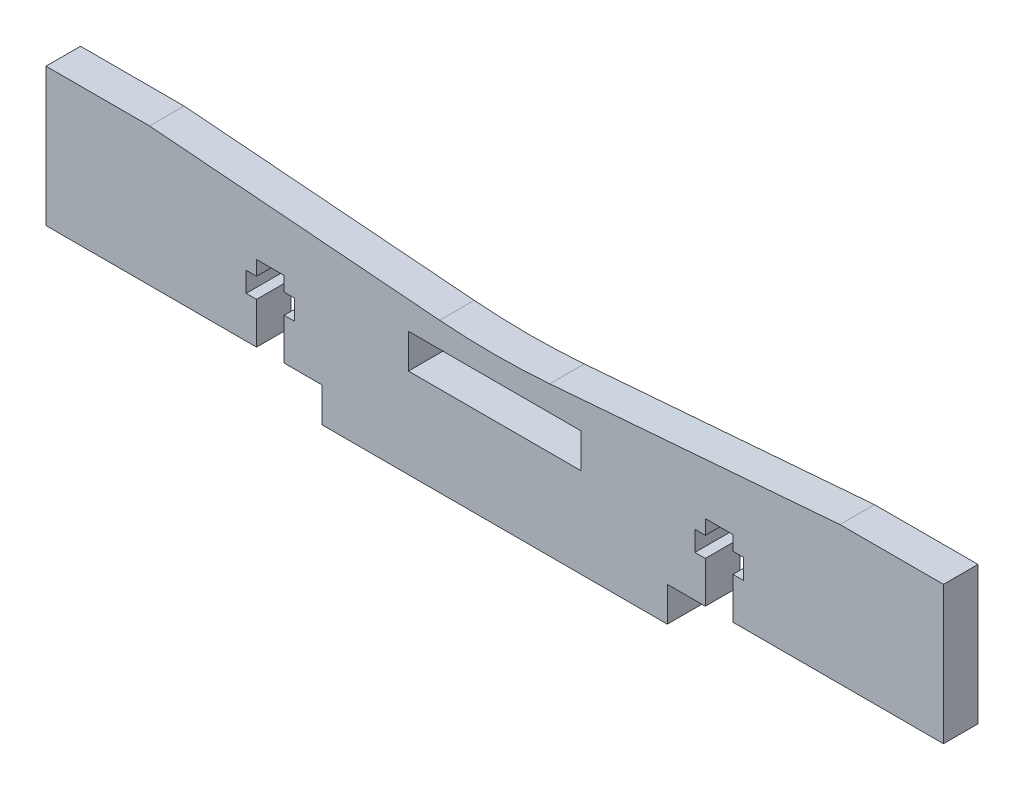
from build123d import *

# Parameters (mm, degrees)
SKETCH_1_W      = 25
SKETCH_1_H      = 5
EXTRUDE_1_DEPTH = 5
FILLET_1_R      = 100


with BuildPart() as part:
    # 草图1 → 凸台-拉伸1 (new body)
    with BuildSketch(Plane.XY):
        Polygon((-40, 0), (-34.5, 0), (-34.5, 6), (-36, 6), (-36, 8.9), (-34.5, 8.9), (-34.5, 11), (-30.5, 11), (-30.5, 8.9), (-29, 8.9), (-29, 6), (-30.5, 6), (-30.5, 0), (0, 0), (0, 20), (-15, 20), (-65, 16), (-115, 20), (-130, 20), (-130, 0), (-99.5, 0), (-99.5, 6), (-101, 6), (-101, 8.9), (-99.5, 8.9), (-99.5, 11), (-95.5, 11), (-95.5, 8.9), (-94, 8.9), (-94, 6), (-95.5, 6), (-95.5, 0), (-90, 0), (-90, -5), (-40, -5), align=None)
        with Locations((-65, 10.5)):
            Rectangle(SKETCH_1_W, SKETCH_1_H, mode=Mode.SUBTRACT)
    extrude(amount=EXTRUDE_1_DEPTH)

    # 圆角1
    fillet_1_edges = [part.edges().sort_by_distance(p)[0] for p in [
        (-65, 16, 2.5),
    ]]
    fillet(fillet_1_edges, radius=FILLET_1_R)


solid = part.part
